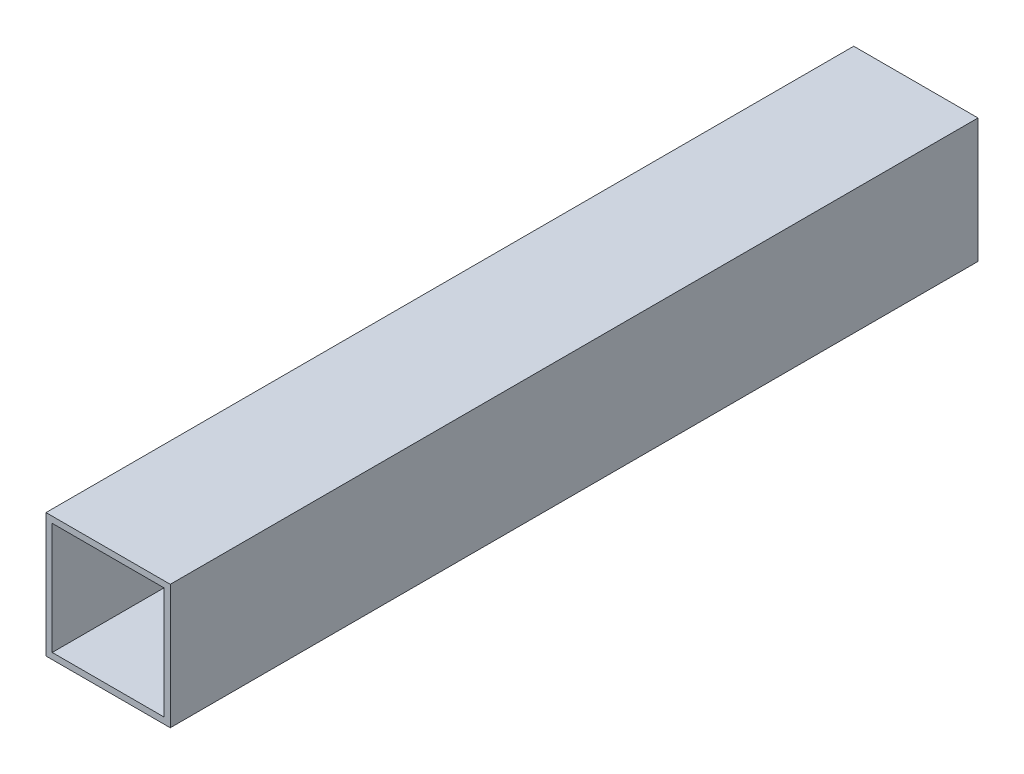
from build123d import *

# Parameters (mm, degrees)
SKETCH1_W           = 100
SKETCH1_H           = 100
SKETCH1_W_2         = 90
SKETCH1_H_2         = 90
BOSS_EXTRUDE1_DEPTH = 325


with BuildPart() as part:
    # Sketch1 → Boss-Extrude1 (new, symmetric)
    with BuildSketch(Plane.XY):
        Rectangle(SKETCH1_W, SKETCH1_H)
        Rectangle(SKETCH1_W_2, SKETCH1_H_2, mode=Mode.SUBTRACT)
    extrude(amount=BOSS_EXTRUDE1_DEPTH, both=True)


solid = part.part
